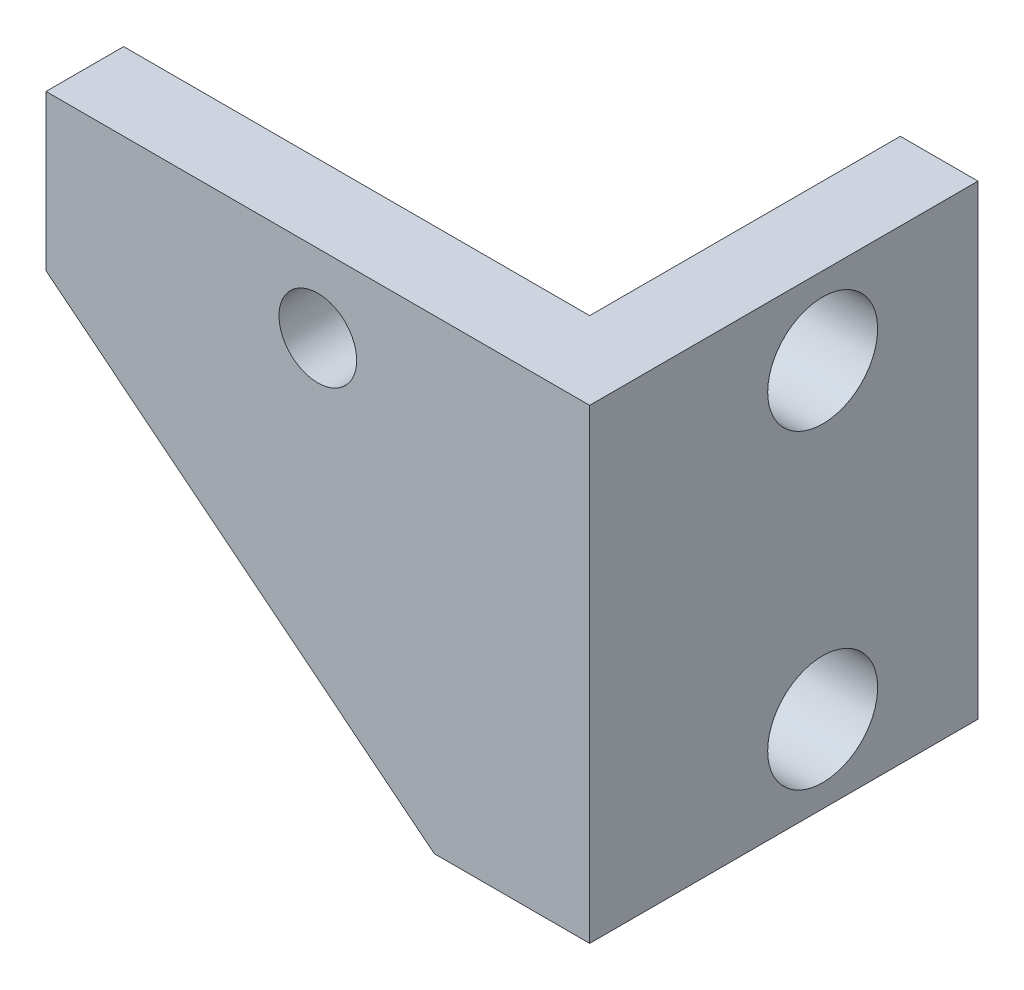
from build123d import *

# Parameters (mm, degrees)
BOSS_EXTRUDE1_DEPTH        = 3.175
F_1_8_0_1250_DOWEL_HOLE2_D = 3.175
SKETCH7_W                  = 3.175
SKETCH7_H                  = 19.05
BOSS_EXTRUDE2_DEPTH        = 15.875
F_8_CLEARANCE_HOLE1_D      = 4.4958


with BuildPart() as part:
    # Sketch1 → Boss-Extrude1 (new body)
    with BuildSketch(Plane.XY):
        Polygon((0, 0), (-22.225, 0), (-22.225, -6.35), (-6.35, -19.05), (0, -19.05), align=None)
    extrude(amount=BOSS_EXTRUDE1_DEPTH)

    # 1/8 (0.1250) Dowel Hole2 (through all)
    with Locations(Plane.XY.offset(3.175)):
        with Locations((-11.1125, -3.175)):
            Hole(F_1_8_0_1250_DOWEL_HOLE2_D / 2)

    # Sketch7 → Boss-Extrude2 (add)
    with BuildSketch(Plane.XY.offset(3.175)):
        with Locations((-1.5875, -9.525)):
            Rectangle(SKETCH7_W, SKETCH7_H)
    extrude(amount=-BOSS_EXTRUDE2_DEPTH)

    # #8 Clearance Hole1 (through all)
    with Locations(Plane.ZY.offset(3.175)):
        with Locations((-6.35, -15.875), (-6.35, -3.175)):
            Hole(F_8_CLEARANCE_HOLE1_D / 2)


solid = part.part
